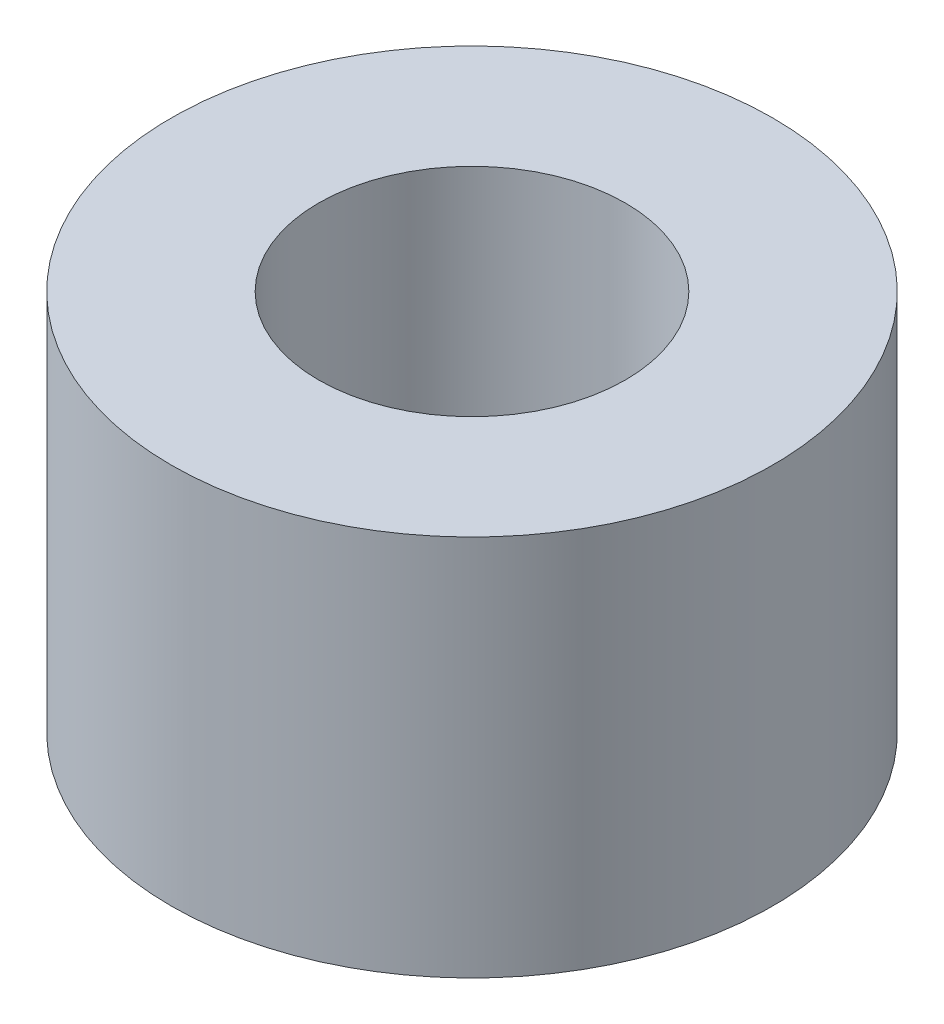
from build123d import *

# Parameters (mm, degrees)
SKETCH1_R           = 5
SKETCH1_R_2         = 2.55
BOSS_EXTRUDE1_DEPTH = 6.35


with BuildPart() as part:
    # Sketch1 → Boss-Extrude1 (new body)
    with BuildSketch(Plane(origin=(0, 0, 0), x_dir=(1, 0, 0), z_dir=(0, 1, 0))):
        with Locations(Location((0, 0, 0), (0, 0, 270))):
            Circle(SKETCH1_R)
        with Locations(Location((0, 0, 0), (0, 0, 270))):
            Circle(SKETCH1_R_2, mode=Mode.SUBTRACT)
    extrude(amount=BOSS_EXTRUDE1_DEPTH)


solid = part.part
